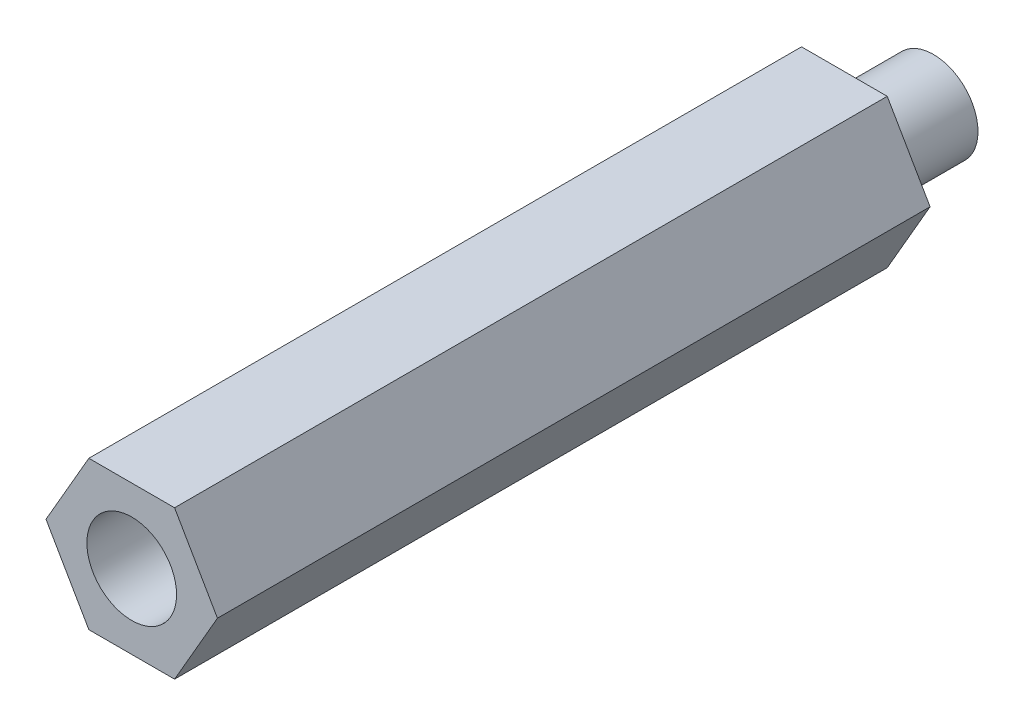
from build123d import *

# Parameters (mm, degrees)
FEMALE_M3_HEX_STANDOFF_AF5_SKETCH_R = 1.51
FEMALE_M3_HEX_STANDOFF_AF5_DEPTH    = 24
STUD_ROOT_SKETCH_R                  = 1.85
STUD_ROOT_DEPTH                     = 0.45
MALE_M3_STUD_ENVELOPE_START         = -3
MALE_M3_STUD_ENVELOPE_SKETCH_R      = 1.5
MALE_M3_STUD_ENVELOPE_DEPTH         = 3


with BuildPart() as part:
    # Female_M3_hex_standoff_AF5_Sketch → Female_M3_hex_standoff_AF5 (new body)
    with BuildSketch(Plane.XY):
        Polygon((2.886751346, 0), (1.443375673, 2.5), (-1.443375673, 2.5), (-2.886751346, 0), (-1.443375673, -2.5), (1.443375673, -2.5), align=None)
        Circle(FEMALE_M3_HEX_STANDOFF_AF5_SKETCH_R, mode=Mode.SUBTRACT)
    extrude(amount=FEMALE_M3_HEX_STANDOFF_AF5_DEPTH)

    # Stud_root_Sketch → Stud_root (add)
    with BuildSketch(Plane.XY):
        Circle(STUD_ROOT_SKETCH_R)
    extrude(amount=STUD_ROOT_DEPTH)

    # Male_M3_stud_envelope_Sketch → Male_M3_stud_envelope (add)
    with BuildSketch(Plane.XY.offset(MALE_M3_STUD_ENVELOPE_START)):
        Circle(MALE_M3_STUD_ENVELOPE_SKETCH_R)
    extrude(amount=MALE_M3_STUD_ENVELOPE_DEPTH)


solid = part.part
